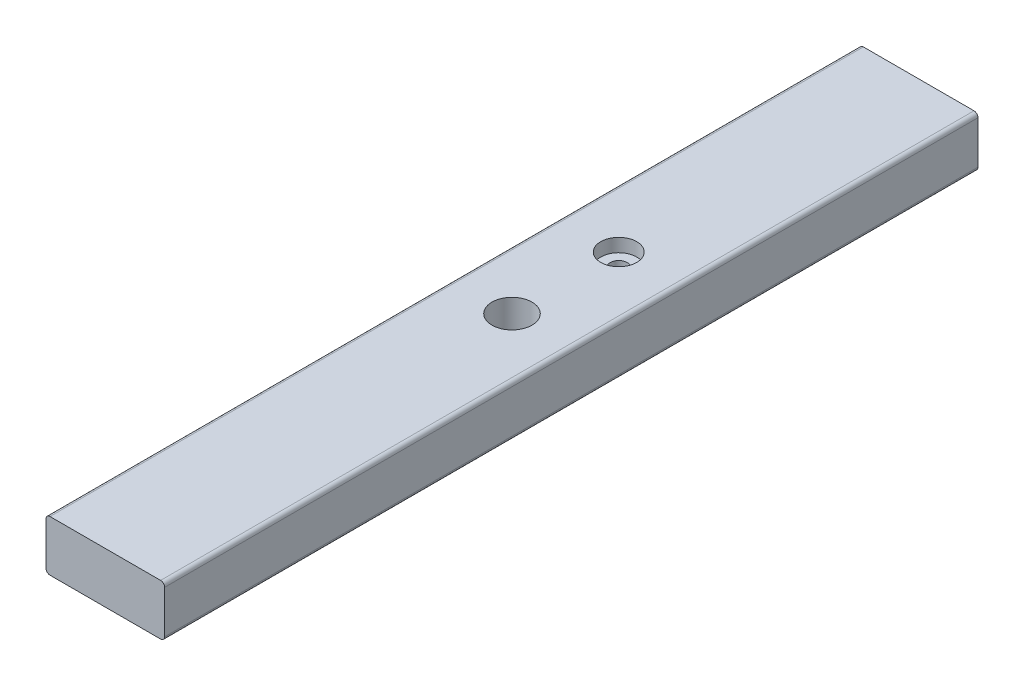
from build123d import *

# Parameters (mm, degrees)
BOSS_EXTRUDE1_DEPTH = 609.6
SKETCH2_R           = 15
SKETCH2_R_2         = 6.35
CUT_EXTRUDE1_DEPTH  = 613.404745654
SKETCH3_R           = 13.5001
CUT_EXTRUDE2_DEPTH  = 10


with BuildPart() as part:
    # Sketch1 → Boss-Extrude1 (new body)
    with BuildSketch(Plane.XY):
        with BuildLine():
            Line((41.45, -19.05), (-41.45, -19.05))
            ThreePointArc((-41.45, -19.05), (-43.571320344, -18.171320344), (-44.45, -16.05))
            Line((-44.45, -16.05), (-44.45, 16.05))
            ThreePointArc((-44.45, 16.05), (-43.571320344, 18.171320344), (-41.45, 19.05))
            Line((-41.45, 19.05), (41.45, 19.05))
            ThreePointArc((41.45, 19.05), (43.571320344, 18.171320344), (44.45, 16.05))
            Line((44.45, 16.05), (44.45, -16.05))
            ThreePointArc((44.45, -16.05), (43.571320344, -18.171320344), (41.45, -19.05))
        make_face()
    extrude(amount=BOSS_EXTRUDE1_DEPTH)

    # Sketch2 → Cut-Extrude1 (cut, through all)
    with BuildSketch(Plane(origin=(0, 19.05, 0), x_dir=(1, 0, 0), z_dir=(0, 1, 0))):
        with Locations(Location((0, -304.8, 0), (0, 0, 180))):
            Circle(SKETCH2_R)
        with Locations(Location((0, -224.8, 0), (0, 0, 180))):
            Circle(SKETCH2_R_2)
    extrude(amount=-CUT_EXTRUDE1_DEPTH, mode=Mode.SUBTRACT)

    # Sketch3 → Cut-Extrude2 (cut)
    with BuildSketch(Plane(origin=(0, 19.05, 0), x_dir=(1, 0, 0), z_dir=(0, 1, 0))):
        with Locations(Location((0, -224.8, 0), (0, 0, 180))):
            Circle(SKETCH3_R)
    cut_extrude2 = extrude(amount=-CUT_EXTRUDE2_DEPTH, mode=Mode.SUBTRACT)

    # Mirror1: Cut-Extrude2 across plane
    add(cut_extrude2.mirror(Plane.ZX), mode=Mode.SUBTRACT)


solid = part.part
